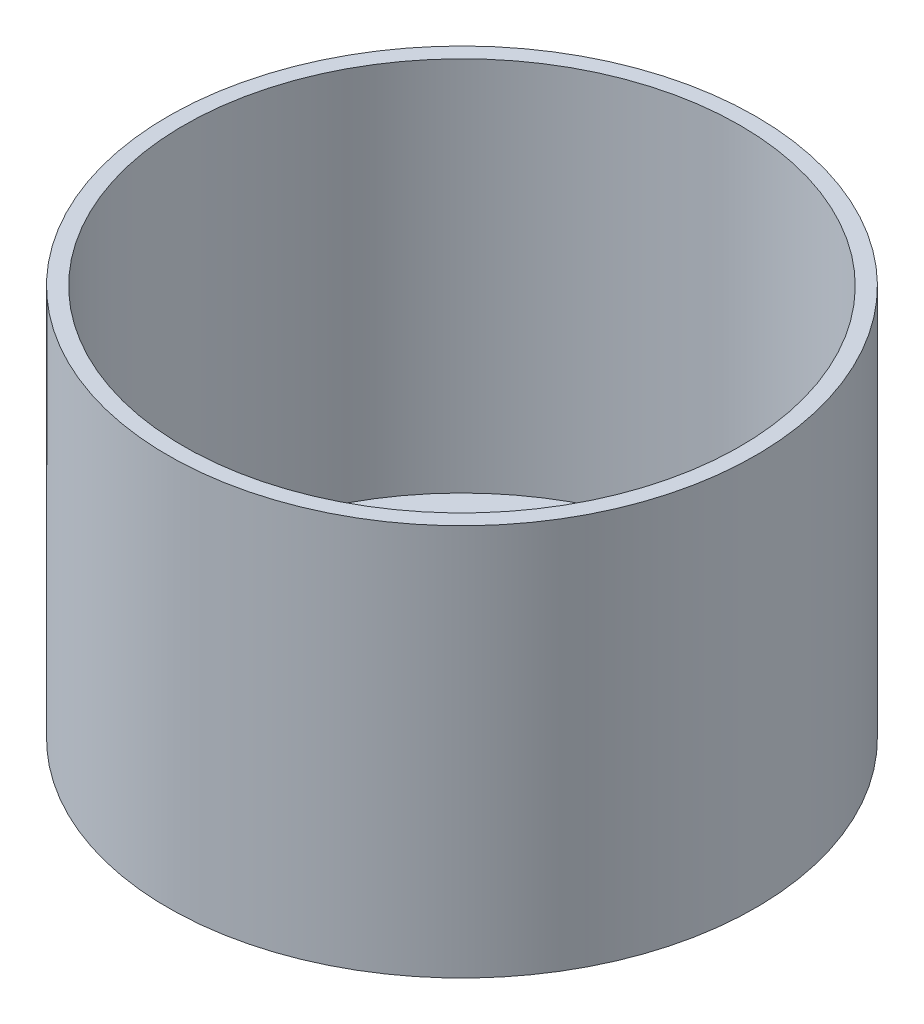
from build123d import *

# Parameters (mm, degrees)
SKETCH2_R          = 4
CUT_EXTRUDE1_DEPTH = 10


with BuildPart() as part:
    # Sketch1 → Revolve1 (revolve)
    with BuildSketch(Plane.XY):
        Polygon((-15, 17.7), (-15, 37.7), (-14.2, 37.7), (-14.2, 18.5), (0, 18.5), (0, 17.7), align=None)
    revolve(axis=Axis((0, 0, 0), (0, 1, 0)))

    # Sketch2 → Cut-Extrude1 (cut)
    with BuildSketch(Plane(origin=(0, 18.5, 0), x_dir=(1, 0, 0), z_dir=(0, 1, 0))):
        Circle(SKETCH2_R)
    extrude(amount=-CUT_EXTRUDE1_DEPTH, mode=Mode.SUBTRACT)


solid = part.part
